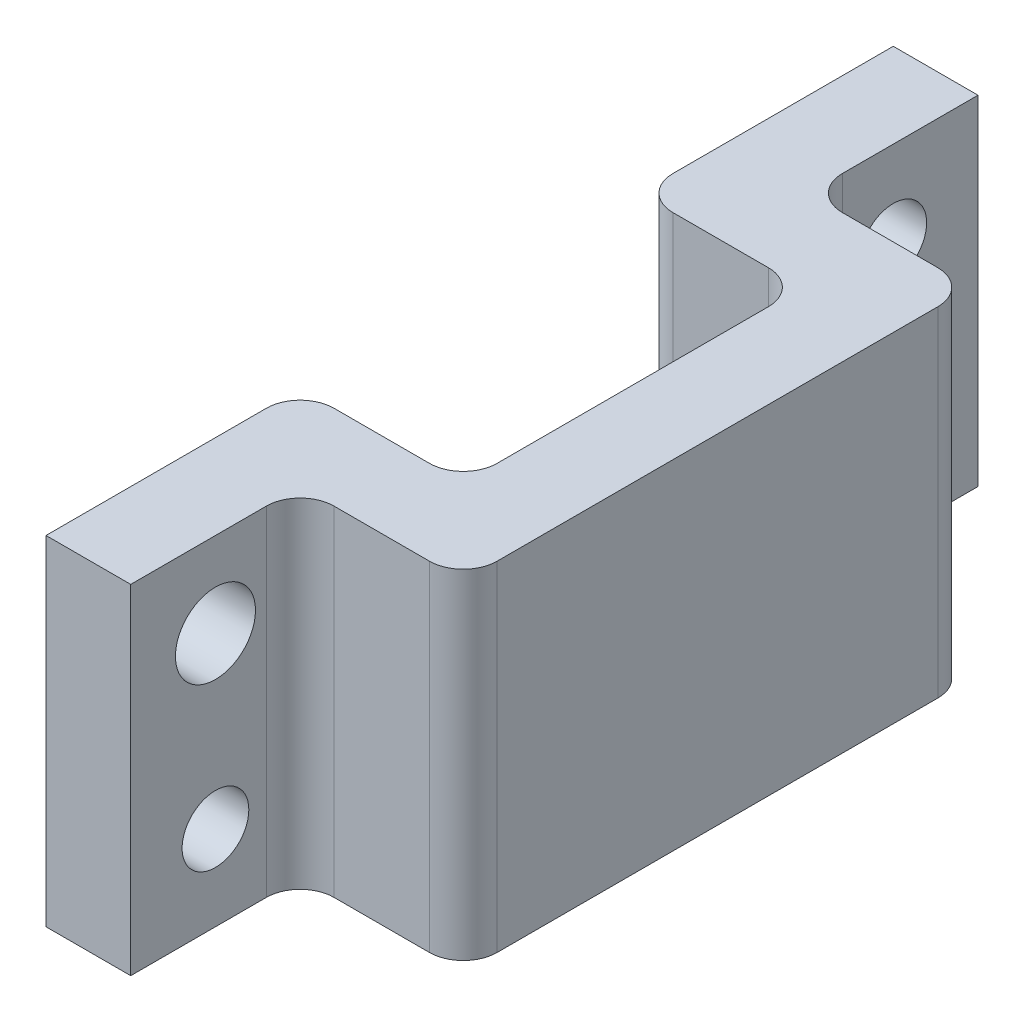
from build123d import *

# Parameters (mm, degrees)
BOSS_EXTRUDE2_DEPTH   = 25.4
CUT_EXTRUDE1_REACH    = 44.458
SKETCH2_R             = 3
M6X1_0_TAPPED_HOLE1_D = 5


with BuildPart() as part:
    # Sketch1 → Boss-Extrude2 (new body)
    with BuildSketch(Plane(origin=(0, 0, 0), x_dir=(1, 0, 0), z_dir=(0, 1, 0))):
        with BuildLine():
            Line((0.47625, 31.75), (0.47625, 15.24))
            ThreePointArc((0.47625, 15.24), (1.220198776, 13.443948776), (3.01625, 12.7))
            Line((3.01625, 12.7), (10.16, 12.7))
            ThreePointArc((10.16, 12.7), (11.956051224, 11.956051224), (12.7, 10.16))
            Line((12.7, 10.16), (12.7, -10.16))
            ThreePointArc((12.7, -10.16), (11.956051224, -11.956051224), (10.16, -12.7))
            Line((10.16, -12.7), (3.01625, -12.7))
            ThreePointArc((3.01625, -12.7), (1.220198776, -13.443948776), (0.47625, -15.24))
            Line((0.47625, -15.24), (0.47625, -31.75))
            Line((0.47625, -31.75), (6.82625, -31.75))
            Line((6.82625, -31.75), (6.82625, -21.59))
            ThreePointArc((6.82625, -21.59), (7.570198776, -19.793948776), (9.36625, -19.05))
            Line((9.36625, -19.05), (16.51, -19.05))
            ThreePointArc((16.51, -19.05), (18.306051224, -18.306051224), (19.05, -16.51))
            Line((19.05, -16.51), (19.05, 16.51))
            ThreePointArc((19.05, 16.51), (18.306051224, 18.306051224), (16.51, 19.05))
            Line((16.51, 19.05), (9.36625, 19.05))
            ThreePointArc((9.36625, 19.05), (7.570198776, 19.793948776), (6.82625, 21.59))
            Line((6.82625, 21.59), (6.82625, 31.75))
            Line((6.82625, 31.75), (0.47625, 31.75))
        make_face()
    extrude(amount=BOSS_EXTRUDE2_DEPTH)

    # Sketch2 → Cut-Extrude1 (cut, up to next)
    with BuildSketch(Plane(origin=(6.82625, 0, 0), x_dir=(0, 0, -1), z_dir=(1, 0, 0)), mode=Mode.PRIVATE) as cut_extrude1_sk1:
        with Locations((-25.4, 19.05)):
            Circle(SKETCH2_R)
    cut_extrude1_tool1 = extrude(cut_extrude1_sk1.sketch, amount=-CUT_EXTRUDE1_REACH, mode=Mode.PRIVATE) & part.part
    # Sketch2 → Cut-Extrude1 (cut, up to next)
    with BuildSketch(Plane(origin=(6.82625, 0, 0), x_dir=(0, 0, -1), z_dir=(1, 0, 0)), mode=Mode.PRIVATE) as cut_extrude1_sk2:
        with Locations((25.4, 6.35)):
            Circle(SKETCH2_R)
    cut_extrude1_tool2 = extrude(cut_extrude1_sk2.sketch, amount=-CUT_EXTRUDE1_REACH, mode=Mode.PRIVATE) & part.part
    add(cut_extrude1_tool1.solids().sort_by_distance((6.82625, 19.05, 25.4))[0], mode=Mode.SUBTRACT)
    add(cut_extrude1_tool2.solids().sort_by_distance((6.82625, 6.35, -25.4))[0], mode=Mode.SUBTRACT)

    # M6x1.0 Tapped Hole1 (through all)
    with Locations(Plane(origin=(6.82625, 0, 0), x_dir=(0, 0, -1), z_dir=(1, 0, 0))):
        with Locations((-25.4, 6.35), (25.4, 19.05)):
            Hole(M6X1_0_TAPPED_HOLE1_D / 2)


solid = part.part
